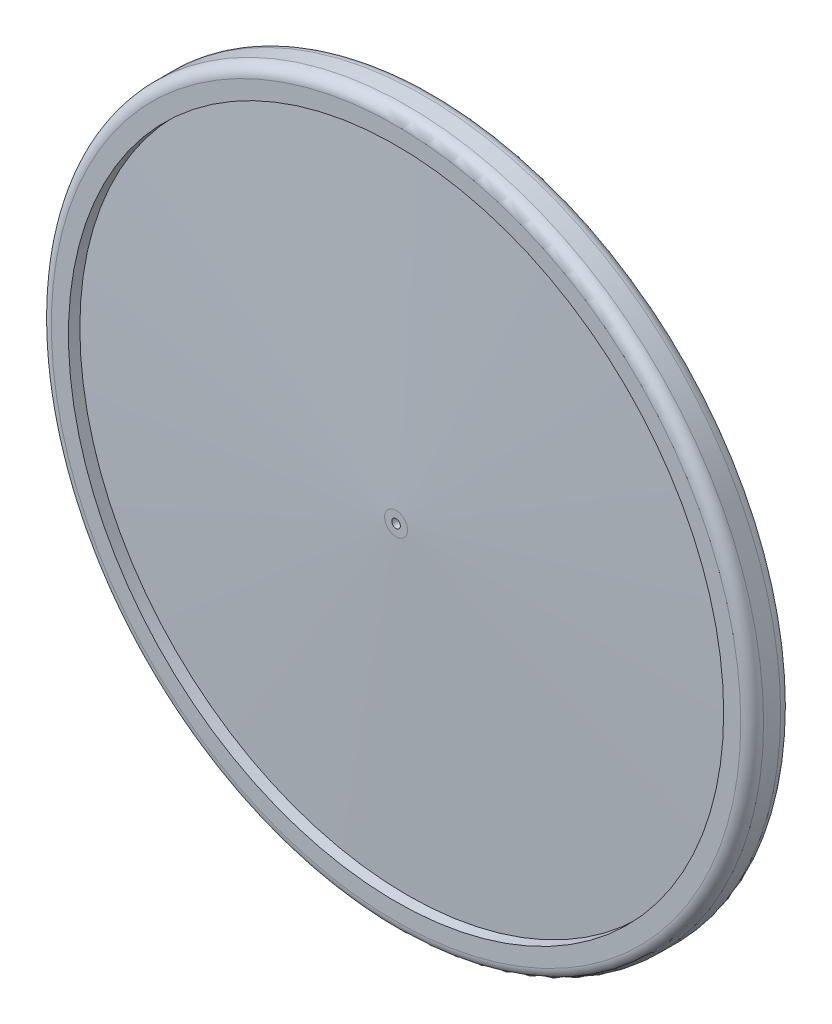
from build123d import *

# Parameters (mm, degrees)
SKETCH5_R          = 3.75
CUT_EXTRUDE1_DEPTH = 72


with BuildPart() as part:
    # Sketch3 → Revolve2 (revolve)
    with BuildSketch(Plane(origin=(0, 0, 0), x_dir=(1, 0, 0), z_dir=(0, 1, 0))):
        with BuildLine():
            Line((287.5, 17.5), (302.5, 17.5))
            ThreePointArc((302.5, 17.5), (309.571067812, 14.571067812), (312.5, 7.5))
            Line((312.5, 7.5), (312.5, -7.5))
            ThreePointArc((312.5, -7.5), (309.571067812, -14.571067812), (302.5, -17.5))
            Line((302.5, -17.5), (287.5, -17.5))
            Line((287.5, -17.5), (287.5, -7.5))
            Line((287.5, -7.5), (10.028182078, -17.5))
            Line((10.028182078, -17.5), (0, -17.5))
            Line((0, -17.5), (0, 17.5))
            Line((0, 17.5), (10.028182078, 17.5))
            Line((10.028182078, 17.5), (287.5, 7.5))
            Line((287.5, 7.5), (287.5, 17.5))
        make_face()
    revolve(axis=Axis((0, 0, 17.5), (0, 0, -1)))

    # Sketch5 → Cut-Extrude1 (cut)
    with BuildSketch(Plane.XY.offset(17.5)):
        Circle(SKETCH5_R)
    extrude(amount=-CUT_EXTRUDE1_DEPTH, mode=Mode.SUBTRACT)


solid = part.part
